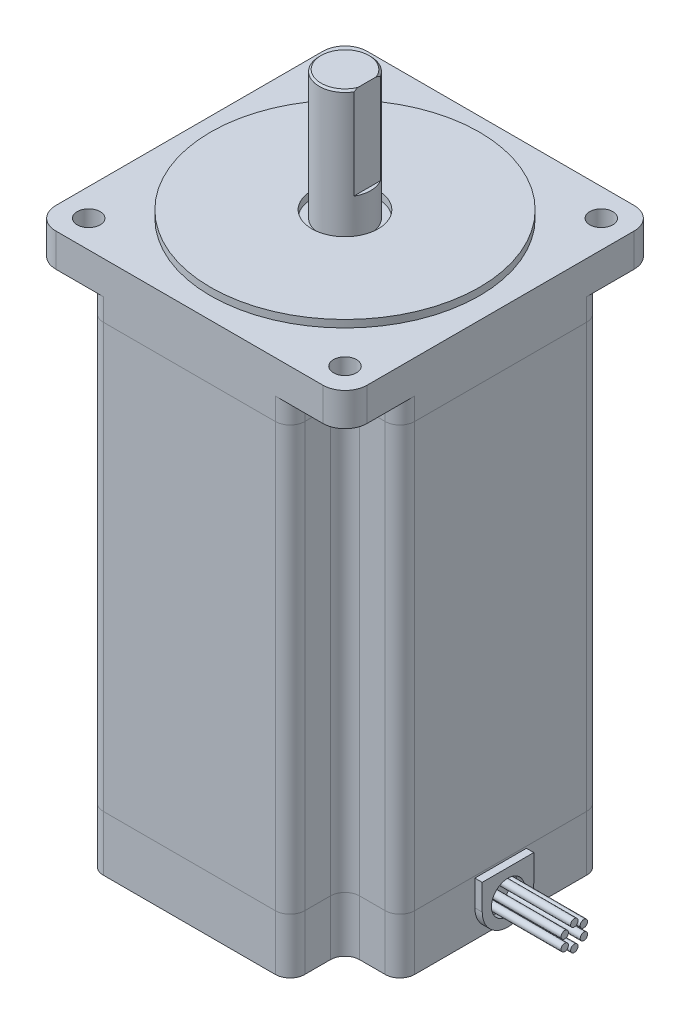
from build123d import *

# Parameters (mm, degrees)
SKETCH1_W             = 84.5
SKETCH1_H             = 84.5
SKETCH1_R             = 3.125
BOSS_EXTRUDE2_DEPTH   = 15
SKETCH2_W             = 84.5
SKETCH2_H             = 84.5
SKETCH2_R             = 3.125
BOSS_EXTRUDE3_DEPTH   = 115
SKETCH3_W             = 84.5
SKETCH3_H             = 84.5
SKETCH3_R             = 3.125
BOSS_EXTRUDE4_DEPTH   = 15
SKETCH4_R             = 4.5
BOSS_EXTRUDE5_DEPTH   = 2
SKETCH5_R             = 1
BOSS_EXTRUDE6_DEPTH   = 20
BOSS_EXTRUDE6_2_DEPTH = 20
BOSS_EXTRUDE6_3_DEPTH = 20
BOSS_EXTRUDE6_4_DEPTH = 20
BOSS_EXTRUDE6_5_DEPTH = 20
BOSS_EXTRUDE6_6_DEPTH = 20
SKETCH6_R             = 36.5
SKETCH6_R_2           = 9
BOSS_EXTRUDE7_DEPTH   = 2
SKETCH7_R             = 7
BOSS_EXTRUDE8_DEPTH   = 35
SKETCH11_W            = 14.92
SKETCH11_H            = 14.92
CUT_EXTRUDE1_DEPTH    = 136
FILLET1_R             = 6
FILLET2_R             = 4
FILLET3_R             = 4
CHAMFER1_SIZE         = 0.5
FILLET4_R             = 4
CUT_EXTRUDE2_DEPTH    = 25


with BuildPart() as part:
    # Sketch1 → Boss-Extrude2 (new body)
    with BuildSketch(Plane(origin=(0, 0, 0), x_dir=(1, 0, 0), z_dir=(0, 1, 0))):
        Rectangle(SKETCH1_W, SKETCH1_H)
        with Locations(Location((34.79, 34.79, 0), (0, 0, 270))):
            Circle(SKETCH1_R, mode=Mode.SUBTRACT)
        with Locations(Location((34.79, -34.79, 0), (0, 0, 270))):
            Circle(SKETCH1_R, mode=Mode.SUBTRACT)
        with Locations(Location((-34.79, -34.79, 0), (0, 0, 270))):
            Circle(SKETCH1_R, mode=Mode.SUBTRACT)
        with Locations(Location((-34.79, 34.79, 0), (0, 0, 270))):
            Circle(SKETCH1_R, mode=Mode.SUBTRACT)
    extrude(amount=BOSS_EXTRUDE2_DEPTH)


with BuildPart() as body_2:
    # Sketch2 → Boss-Extrude3 (new body)
    with BuildSketch(Plane(origin=(0, 15, 0), x_dir=(1, 0, 0), z_dir=(0, 1, 0))):
        Rectangle(SKETCH2_W, SKETCH2_H)
        with Locations(Location((-34.79, -34.79, 0), (0, 0, 270))):
            Circle(SKETCH2_R, mode=Mode.SUBTRACT)
        with Locations(Location((34.79, -34.79, 0), (0, 0, 270))):
            Circle(SKETCH2_R, mode=Mode.SUBTRACT)
        with Locations(Location((34.79, 34.79, 0), (0, 0, 270))):
            Circle(SKETCH2_R, mode=Mode.SUBTRACT)
        with Locations(Location((-34.79, 34.79, 0), (0, 0, 270))):
            Circle(SKETCH2_R, mode=Mode.SUBTRACT)
    extrude(amount=BOSS_EXTRUDE3_DEPTH)


with BuildPart() as body_3:
    # Sketch3 → Boss-Extrude4 (new body)
    with BuildSketch(Plane(origin=(0, 130, 0), x_dir=(1, 0, 0), z_dir=(0, 1, 0))):
        Rectangle(SKETCH3_W, SKETCH3_H)
        with Locations(Location((34.79, 34.79, 0), (0, 0, 270))):
            Circle(SKETCH3_R, mode=Mode.SUBTRACT)
        with Locations(Location((34.79, -34.79, 0), (0, 0, 270))):
            Circle(SKETCH3_R, mode=Mode.SUBTRACT)
        with Locations(Location((-34.79, -34.79, 0), (0, 0, 270))):
            Circle(SKETCH3_R, mode=Mode.SUBTRACT)
        with Locations(Location((-34.79, 34.79, 0), (0, 0, 270))):
            Circle(SKETCH3_R, mode=Mode.SUBTRACT)
    extrude(amount=BOSS_EXTRUDE4_DEPTH)

    # Sketch6 → Boss-Extrude7 (add)
    with BuildSketch(Plane(origin=(0, 145, 0), x_dir=(1, 0, 0), z_dir=(0, 1, 0))):
        with Locations(Location((0, 0, 0), (0, 0, 270))):
            Circle(SKETCH6_R)
        with Locations(Location((0, 0, 0), (0, 0, 270))):
            Circle(SKETCH6_R_2, mode=Mode.SUBTRACT)
    extrude(amount=BOSS_EXTRUDE7_DEPTH)


with BuildPart() as body_4:
    # Sketch4 → Boss-Extrude5 (new body)
    with BuildSketch(Plane(origin=(42.25, 0, 0), x_dir=(0, 0, -1), z_dir=(1, 0, 0))):
        with BuildLine():
            Line((-7, 7.5), (-7, 14.5))
            Line((-7, 14.5), (7, 14.5))
            Line((7, 14.5), (7, 7.5))
            ThreePointArc((7, 7.5), (0, 0.5), (-7, 7.5))
        make_face()
        with Locations((0, 7.5)):
            Circle(SKETCH4_R, mode=Mode.SUBTRACT)
    extrude(amount=BOSS_EXTRUDE5_DEPTH)


with BuildPart() as body_5:
    # Sketch5 → Boss-Extrude6 (new body)
    with BuildSketch(Plane(origin=(42.25, 0, 0), x_dir=(0, 0, -1), z_dir=(1, 0, 0))):
        with Locations((-2.598076211, 6)):
            Circle(SKETCH5_R)
    extrude(amount=BOSS_EXTRUDE6_DEPTH)


with BuildPart() as body_6:
    # Sketch5 → Boss-Extrude6 2 (new body)
    with BuildSketch(Plane(origin=(42.25, 0, 0), x_dir=(0, 0, -1), z_dir=(1, 0, 0))):
        with Locations((0, 4.5)):
            Circle(SKETCH5_R)
    extrude(amount=BOSS_EXTRUDE6_2_DEPTH)


with BuildPart() as body_7:
    # Sketch5 → Boss-Extrude6 3 (new body)
    with BuildSketch(Plane(origin=(42.25, 0, 0), x_dir=(0, 0, -1), z_dir=(1, 0, 0))):
        with Locations((-2.598076211, 9)):
            Circle(SKETCH5_R)
    extrude(amount=BOSS_EXTRUDE6_3_DEPTH)


with BuildPart() as body_8:
    # Sketch5 → Boss-Extrude6 4 (new body)
    with BuildSketch(Plane(origin=(42.25, 0, 0), x_dir=(0, 0, -1), z_dir=(1, 0, 0))):
        with Locations((0, 10.5)):
            Circle(SKETCH5_R)
    extrude(amount=BOSS_EXTRUDE6_4_DEPTH)


with BuildPart() as body_9:
    # Sketch5 → Boss-Extrude6 5 (new body)
    with BuildSketch(Plane(origin=(42.25, 0, 0), x_dir=(0, 0, -1), z_dir=(1, 0, 0))):
        with Locations((2.598076211, 9)):
            Circle(SKETCH5_R)
    extrude(amount=BOSS_EXTRUDE6_5_DEPTH)


with BuildPart() as body_10:
    # Sketch5 → Boss-Extrude6 6 (new body)
    with BuildSketch(Plane(origin=(42.25, 0, 0), x_dir=(0, 0, -1), z_dir=(1, 0, 0))):
        with Locations((2.598076211, 6)):
            Circle(SKETCH5_R)
    extrude(amount=BOSS_EXTRUDE6_6_DEPTH)


with BuildPart() as body_11:
    # Sketch7 → Boss-Extrude8 (new body)
    with BuildSketch(Plane(origin=(0, 145, 0), x_dir=(1, 0, 0), z_dir=(0, 1, 0))):
        with Locations(Location((0, 0, 0), (0, 0, 270))):
            Circle(SKETCH7_R)
    extrude(amount=BOSS_EXTRUDE8_DEPTH)

    # Chamfer1
    chamfer1_edges = [body_11.edges().sort_by_distance(p)[0] for p in [
        (0, 180, -7),
    ]]
    chamfer(chamfer1_edges, length=CHAMFER1_SIZE)

    # Sketch12 → Cut-Extrude2 (cut)
    with BuildSketch(Plane(origin=(0, 180, 0), x_dir=(1, 0, 0), z_dir=(0, 1, 0))):
        with BuildLine():
            Line((6, 3.605551275), (6, -3.605551275))
            ThreePointArc((6, -3.605551275), (7, 0), (6, 3.605551275))
        make_face()
    extrude(amount=-CUT_EXTRUDE2_DEPTH, mode=Mode.SUBTRACT)


with BuildPart() as cut_extrude1_tool:
    # Sketch11 → Cut-Extrude1 (new body)
    with BuildSketch(Plane.XZ):
        with Locations((34.79, 34.79)):
            Rectangle(SKETCH11_W, SKETCH11_H)
        with Locations((-34.79, 34.79)):
            Rectangle(SKETCH11_W, SKETCH11_H)
        with Locations((34.79, -34.79)):
            Rectangle(SKETCH11_W, SKETCH11_H)
        with Locations((-34.79, -34.79)):
            Rectangle(SKETCH11_W, SKETCH11_H)
    extrude(amount=-CUT_EXTRUDE1_DEPTH)


with BuildPart() as part_1:
    add(part.part)

    # Cut-Extrude1: cut by cut_extrude1_tool
    add(cut_extrude1_tool.part, mode=Mode.SUBTRACT)

    # Fillet2
    fillet2_edges = [part_1.edges().sort_by_distance(p)[0] for p in [
        (-27.33, 7.5, -42.25),
        (27.33, 7.5, -42.25),
        (42.25, 7.5, 27.33),
        (-27.33, 7.5, 42.25),
        (27.33, 7.5, 27.33),
        (27.33, 7.5, 42.25),
        (-27.33, 7.5, 27.33),
        (-42.25, 7.5, 27.33),
        (27.33, 7.5, -27.33),
        (42.25, 7.5, -27.33),
        (-27.33, 7.5, -27.33),
        (-42.25, 7.5, -27.33),
    ]]
    fillet(fillet2_edges, radius=FILLET2_R)


with BuildPart() as body_2_1:
    add(body_2.part)

    # Cut-Extrude1: cut by cut_extrude1_tool
    add(cut_extrude1_tool.part, mode=Mode.SUBTRACT)

    # Fillet3
    fillet3_edges = [body_2_1.edges().sort_by_distance(p)[0] for p in [
        (-27.33, 72.5, -42.25),
        (27.33, 72.5, -42.25),
        (42.25, 72.5, 27.33),
        (-27.33, 72.5, 42.25),
        (27.33, 72.5, 27.33),
        (27.33, 72.5, 42.25),
        (-27.33, 72.5, 27.33),
        (-42.25, 72.5, 27.33),
        (27.33, 72.5, -27.33),
        (42.25, 72.5, -27.33),
        (-42.25, 72.5, -27.33),
        (-27.33, 72.5, -27.33),
    ]]
    fillet(fillet3_edges, radius=FILLET3_R)


with BuildPart() as body_3_1:
    add(body_3.part)

    # Cut-Extrude1: cut by cut_extrude1_tool
    add(cut_extrude1_tool.part, mode=Mode.SUBTRACT)

    # Fillet1
    fillet1_edges = [body_3_1.edges().sort_by_distance(p)[0] for p in [
        (-42.25, 140.5, -42.25),
        (42.25, 140.5, -42.25),
        (42.25, 140.5, 42.25),
        (-42.25, 140.5, 42.25),
    ]]
    fillet(fillet1_edges, radius=FILLET1_R)

    # Fillet4
    fillet4_edges = [body_3_1.edges().sort_by_distance(p)[0] for p in [
        (27.33, 133, 27.33),
        (42.25, 133, 27.33),
        (27.33, 133, 42.25),
        (-27.33, 133, 27.33),
        (-27.33, 133, 42.25),
        (-42.25, 133, 27.33),
        (27.33, 133, -27.33),
        (27.33, 133, -42.25),
        (42.25, 133, -27.33),
        (-42.25, 133, -27.33),
        (-27.33, 133, -42.25),
        (-27.33, 133, -27.33),
    ]]
    fillet(fillet4_edges, radius=FILLET4_R)


solid = Compound([body_4.part, body_5.part, body_6.part, body_7.part, body_8.part, body_9.part, body_10.part, body_11.part, part_1.part, body_2_1.part, body_3_1.part])
